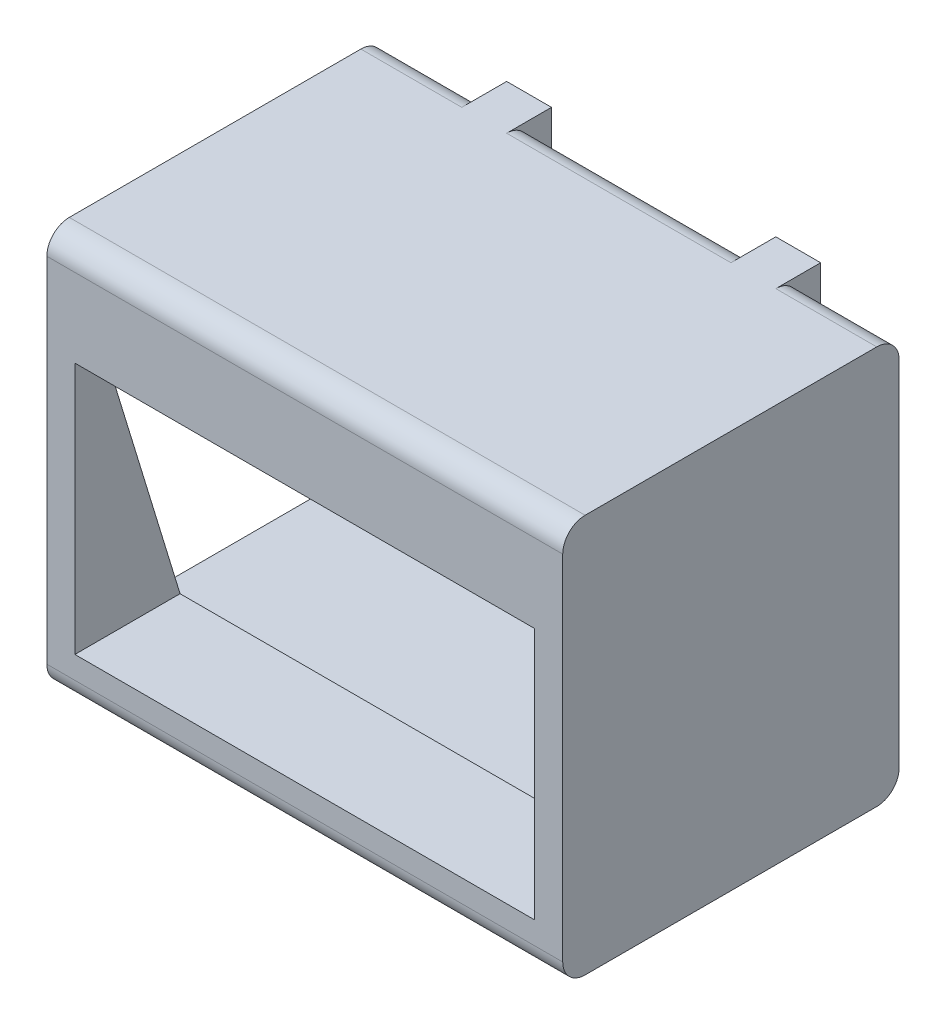
from build123d import *

# Parameters (mm, degrees)
BASE_DEPTH               = 46
BASE_DEPTH_BACK          = 46
SKETCH4_W                = 60
SKETCH4_H                = 71
LIDAR_DEPTH              = 41
LIDAR_DEPTH_BACK         = 46
HOLEFRONTBACK_DEPTH      = 68.068994327
HOLEFRONTBACK_DEPTH_BACK = 68.068994327
SKETCH6_W                = 82
SKETCH6_H                = 45
FILLET2_R                = 4
SKETCH10_R               = 2
CUT_EXTRUDE1_DEPTH       = 4
BOSS_EXTRUDE1_DEPTH      = 4
BOSS_EXTRUDE1_DEPTH_BACK = 4
SKETCH11_W               = 8
SKETCH11_H               = 71
SKETCH12_R               = 2
CUT_EXTRUDE2_DEPTH       = 4


with BuildPart() as part:
    # Sketch4 → Base (new, two sides: drawn at the far end of the back side and taken through both)
    with BuildSketch(Plane(origin=(0, 0, 0), x_dir=(0, 0, -1), z_dir=(1, 0, 0)).offset(-BASE_DEPTH_BACK)):
        with Locations((0, -3)):
            Rectangle(SKETCH4_W, SKETCH4_H)
    extrude(amount=BASE_DEPTH + BASE_DEPTH_BACK)

    # Sketch5 → LIDAR (cut, two sides: drawn at the far end of the back side and taken through both)
    with BuildSketch(Plane(origin=(0, 0, 0), x_dir=(0, 0, -1), z_dir=(1, 0, 0)).offset(-LIDAR_DEPTH_BACK)):
        Polygon((-25, 27.5), (-25, 14.5), (-10.630657971, -32.5), (25, -32.5), (25, 27.5), align=None)
    extrude(amount=LIDAR_DEPTH + LIDAR_DEPTH_BACK, mode=Mode.SUBTRACT)

    # Sketch6 → HoleFrontBack (cut, two sides: drawn at the far end of the back side and taken through both)
    with BuildSketch(Plane.XY.offset(-HOLEFRONTBACK_DEPTH_BACK)):
        with Locations((0, -8)):
            Rectangle(SKETCH6_W, SKETCH6_H)
    extrude(amount=HOLEFRONTBACK_DEPTH + HOLEFRONTBACK_DEPTH_BACK, mode=Mode.SUBTRACT)

    # Fillet2
    fillet2_edges = [part.edges().sort_by_distance(p)[0] for p in [
        (0, 32.5, 30),
        (0, 32.5, -30),
        (0, -38.5, -30),
        (0, -38.5, 30),
    ]]
    fillet(fillet2_edges, radius=FILLET2_R)

    # Sketch10 → Cut-Extrude1 (cut)
    with BuildSketch(Plane.XZ.offset(38.5)):
        with Locations(Location((-23.335, 14, 0), (0, 0, 270))):
            Circle(SKETCH10_R)
        with Locations(Location((23.335, 14, 0), (0, 0, 270))):
            Circle(SKETCH10_R)
        with Locations(Location((-23.335, -18, 0), (0, 0, 270))):
            Circle(SKETCH10_R)
        with Locations(Location((23.335, -18, 0), (0, 0, 270))):
            Circle(SKETCH10_R)
    extrude(amount=-CUT_EXTRUDE1_DEPTH, mode=Mode.SUBTRACT)

    # Sketch11 → Boss-Extrude1 (add, two sides: drawn at the far end of the back side and taken through both)
    with BuildSketch(Plane(origin=(0, 0, -30), x_dir=(-1, 0, 0), z_dir=(0, 0, -1)).offset(-BOSS_EXTRUDE1_DEPTH_BACK)):
        with Locations((-24, -3)):
            Rectangle(SKETCH11_W, SKETCH11_H)
        with Locations((24, -3)):
            Rectangle(SKETCH11_W, SKETCH11_H)
    extrude(amount=BOSS_EXTRUDE1_DEPTH + BOSS_EXTRUDE1_DEPTH_BACK)

    # Sketch12 → Cut-Extrude2 (cut)
    with BuildSketch(Plane(origin=(0, 0, -34), x_dir=(-1, 0, 0), z_dir=(0, 0, -1))):
        with Locations(Location((-24, 16, 0), (0, 0, 90))):
            Circle(SKETCH12_R)
        with Locations(Location((24, 16, 0), (0, 0, 90))):
            Circle(SKETCH12_R)
        with Locations(Location((-24, -16, 0), (0, 0, 90))):
            Circle(SKETCH12_R)
        with Locations(Location((24, -16, 0), (0, 0, 90))):
            Circle(SKETCH12_R)
    extrude(amount=-CUT_EXTRUDE2_DEPTH, mode=Mode.SUBTRACT)


solid = part.part
